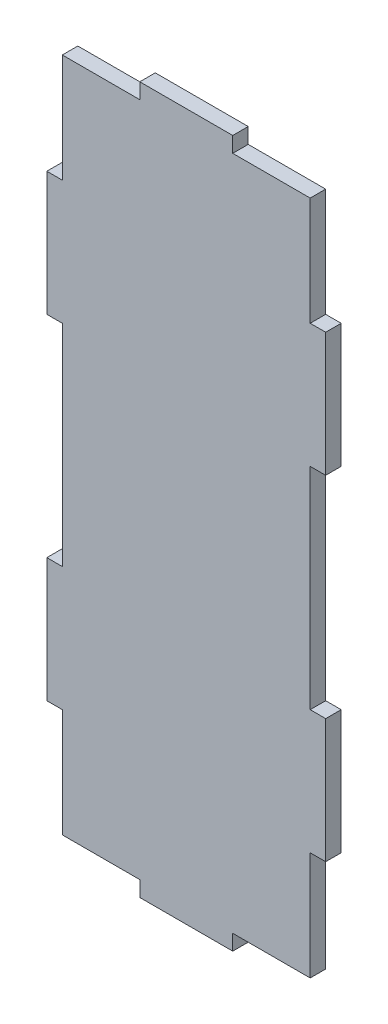
from build123d import *

# Parameters (mm, degrees)
BOSS_EXTRUDE1_DEPTH = 3.175


with BuildPart() as part:
    # Sketch1 → Boss-Extrude1 (new body)
    with BuildSketch(Plane.XY):
        Polygon((15.875, 138.43), (15.875, 141.605), (34.925, 141.605), (34.925, 138.43), (50.8, 138.43), (50.8, 116.205), (53.975, 116.205), (53.975, 90.805), (50.8, 90.805), (50.8, 47.625), (53.975, 47.625), (53.975, 22.225), (50.8, 22.225), (50.8, 0), (34.925, 0), (34.925, -3.175), (15.875, -3.175), (15.875, 0), (0, 0), (0, 22.225), (-3.175, 22.225), (-3.175, 47.625), (0, 47.625), (0, 90.805), (-3.175, 90.805), (-3.175, 116.205), (0, 116.205), (0, 138.43), align=None)
    extrude(amount=BOSS_EXTRUDE1_DEPTH)


solid = part.part
